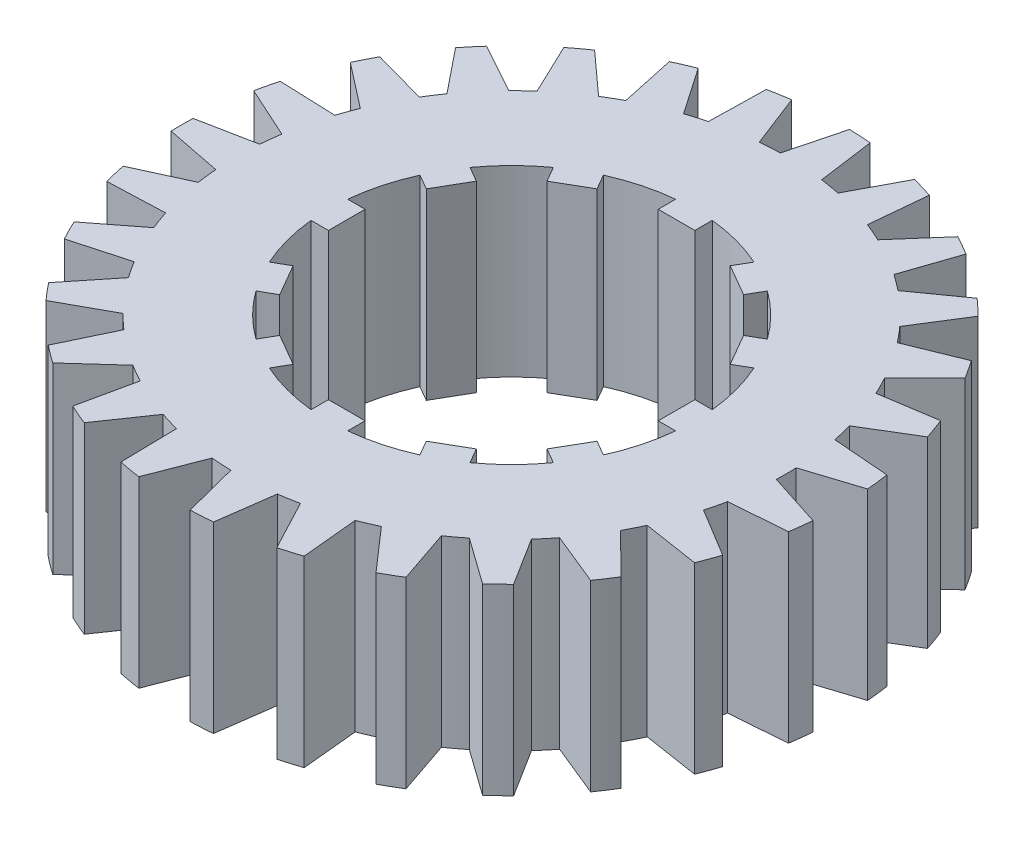
from build123d import *

# Parameters (mm, degrees)
SKETCH1_R           = 15
SKETCH1_R_2         = 10
BOSS_EXTRUDE1_DEPTH = 5
BOSS_EXTRUDE2_DEPTH = 5
BOSS_EXTRUDE3_DEPTH = 5
CIRPATTERN1_COUNT   = 12
CIRPATTERN2_COUNT   = 27


with BuildPart() as part:
    # Sketch1 → Boss-Extrude1 (new, symmetric)
    with BuildSketch(Plane(origin=(0, 0, 0), x_dir=(-1, 0, 0), z_dir=(0, 1, 0))):
        Circle(SKETCH1_R)
        Circle(SKETCH1_R_2, mode=Mode.SUBTRACT)
    extrude(amount=BOSS_EXTRUDE1_DEPTH, both=True)

    # Sketch1<3> → Boss-Extrude2 (add, symmetric)
    with BuildSketch(Plane(origin=(0, 0, 0), x_dir=(-1, 0, 0), z_dir=(0, 1, 0))):
        with BuildLine():
            ThreePointArc((17.989997221, -0.6), (18, 0), (17.989997221, 0.6))
            Line((17.989997221, 0.6), (14.951922953, 1.2))
            ThreePointArc((14.951922953, 1.2), (14.987975919, 0.600481349), (15, 0))
            ThreePointArc((15, 0), (14.987975919, -0.600481349), (14.951922953, -1.2))
            Line((14.951922953, -1.2), (17.989997221, -0.6))
        make_face()
    boss_extrude2 = extrude(amount=BOSS_EXTRUDE2_DEPTH, both=True)

    # Sketch1<4> → Boss-Extrude3 (add, symmetric)
    with BuildSketch(Plane(origin=(0, 0, 0), x_dir=(-1, 0, 0), z_dir=(0, 1, 0))):
        with BuildLine():
            ThreePointArc((1, 9.949874371), (0.500627751, 9.987460731), (0, 10))
            ThreePointArc((0, 10), (-0.500627751, 9.987460731), (-1, 9.949874371))
            Line((-1, 9.949874371), (-1, 9))
            Line((-1, 9), (1, 9))
            Line((1, 9), (1, 9.949874371))
        make_face()
    boss_extrude3 = extrude(amount=BOSS_EXTRUDE3_DEPTH, both=True)

    # CirPattern1: Boss-Extrude3 ×12 about axis
    cirpattern1_axis = Axis((0, 5, 0), (0, 1, 0))
    for i in range(1, CIRPATTERN1_COUNT):
        add(boss_extrude3.rotate(cirpattern1_axis, i * 360 / CIRPATTERN1_COUNT))

    # CirPattern2: Boss-Extrude2 ×27 about axis
    cirpattern2_axis = Axis((0, -5, 0), (0, 1, 0))
    for i in range(1, CIRPATTERN2_COUNT):
        add(boss_extrude2.rotate(cirpattern2_axis, i * 360 / CIRPATTERN2_COUNT))


solid = part.part
